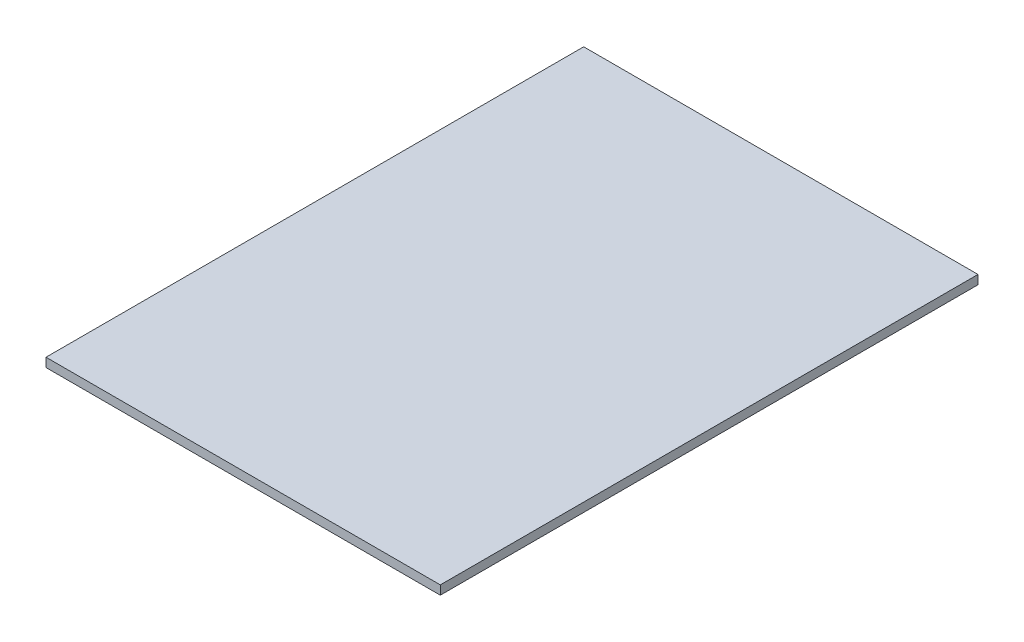
from build123d import *

# Parameters (mm, degrees)
ESQUISSE1_W        = 220
ESQUISSE1_H        = 300
BOSS_EXTRU_1_DEPTH = 5


with BuildPart() as part:
    # Esquisse1 → Boss.-Extru.1 (new body)
    with BuildSketch(Plane(origin=(0, 0, 0), x_dir=(1, 0, 0), z_dir=(0, 1, 0))):
        Rectangle(ESQUISSE1_W, ESQUISSE1_H)
    extrude(amount=BOSS_EXTRU_1_DEPTH)


solid = part.part
